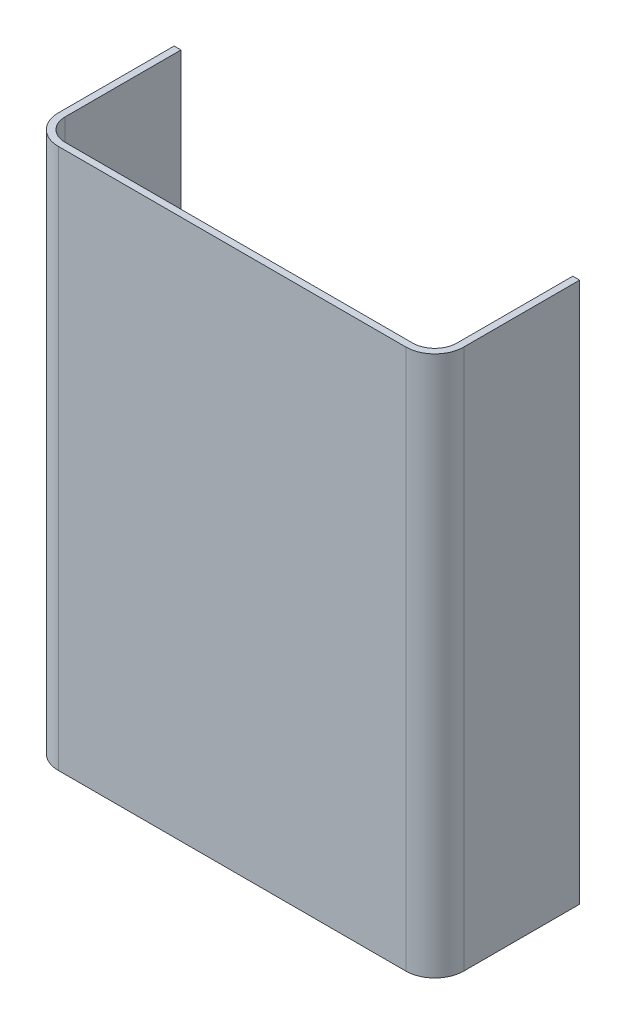
from build123d import *

# Parameters (mm, degrees)
BOSS_EXTRUDE1_DEPTH = 237


with BuildPart() as part:
    # Sketch1 → Boss-Extrude1 (new body)
    with BuildSketch(Plane(origin=(0, 0, 0), x_dir=(1, 0, 0), z_dir=(0, 1, 0))):
        with BuildLine():
            Line((-88.9, 0), (-88.9, -50.8))
            ThreePointArc((-88.9, -50.8), (-85.180256121, -59.780256121), (-76.2, -63.5))
            Line((-76.2, -63.5), (76.2, -63.5))
            ThreePointArc((76.2, -63.5), (85.180256121, -59.780256121), (88.9, -50.8))
            Line((88.9, -50.8), (88.9, 0))
            Line((88.9, 0), (85.9, 0))
            Line((85.9, 0), (85.9, -50.8))
            ThreePointArc((85.9, -50.8), (83.058935778, -57.658935778), (76.2, -60.5))
            Line((76.2, -60.5), (-76.2, -60.5))
            ThreePointArc((-76.2, -60.5), (-83.058935778, -57.658935778), (-85.9, -50.8))
            Line((-85.9, -50.8), (-85.9, 0))
            Line((-85.9, 0), (-88.9, 0))
        make_face()
    extrude(amount=BOSS_EXTRUDE1_DEPTH)


solid = part.part
